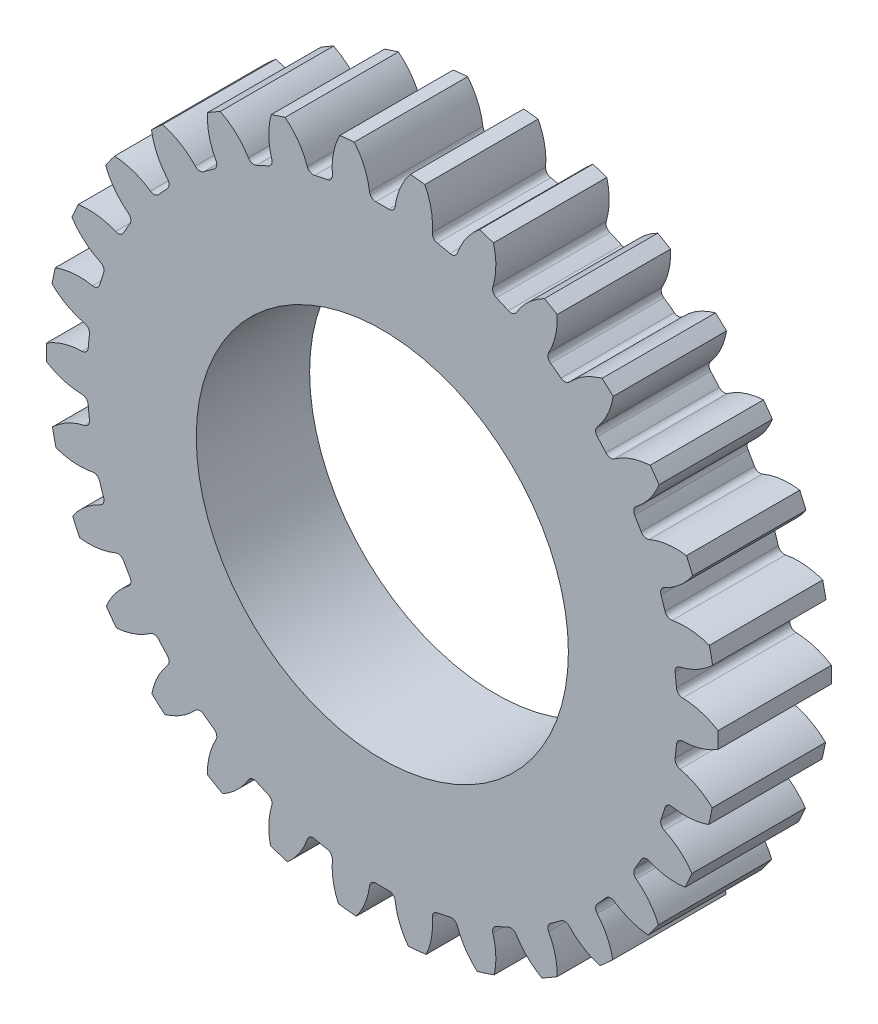
from build123d import *

# Parameters (mm, degrees)
SKETCH1_R                = 26.665
BOSS_EXTRUDE1_DEPTH      = 4.5
CUT_EXTRUDE1_DEPTH       = 8.335
FILLET1_R                = 0.5
CIRPATTERN1_COUNT        = 30
FILLET1_OF_CIRPATTERN1_R = 0.5
SKETCH3_R                = 13
CUT_EXTRUDE2_DEPTH       = 39.713938954
SCALE1_SCALE             = 0.88
SKETCH4_R                = 13
CUT_EXTRUDE3_DEPTH       = 10


with BuildPart() as part:
    # Sketch1 → Boss-Extrude1 (new, symmetric)
    with BuildSketch(Plane.XY):
        Circle(SKETCH1_R)
    extrude(amount=BOSS_EXTRUDE1_DEPTH, both=True)

    # Sketch2 → Cut-Extrude1 (cut, symmetric)
    with BuildSketch(Plane.XY):
        with BuildLine():
            ThreePointArc((0.980310331, 23.309394923), (0, 23.33), (-0.980310331, 23.309394923))
            ThreePointArc((-0.980310331, 23.309394923), (-1.606891498, 25.641377876), (-3.168766736, 27.48292456))
            ThreePointArc((-3.168766736, 27.48292456), (0, 27.665), (3.168766736, 27.48292456))
            ThreePointArc((3.168766736, 27.48292456), (1.606891498, 25.641377876), (0.980310331, 23.309394923))
        make_face()
    cut_extrude1 = extrude(amount=CUT_EXTRUDE1_DEPTH, both=True, mode=Mode.SUBTRACT)

    # Fillet1
    fillet1_edges = [part.edges().sort_by_distance(p)[0] for p in [
        (0.980310331, 23.309394923, 0),
        (-0.980310331, 23.309394923, 0),
    ]]
    fillet(fillet1_edges, radius=FILLET1_R)

    # CirPattern1: Cut-Extrude1 ×30 about axis
    cirpattern1_axis = Axis((0, -0.105317808, 0), (0, 0, 1))
    for i in range(1, CIRPATTERN1_COUNT):
        add(cut_extrude1.rotate(cirpattern1_axis, i * 360 / CIRPATTERN1_COUNT), mode=Mode.SUBTRACT)

    # Fillet1 of CirPattern1
    fillet1_of_cirpattern1_edges = [part.edges().sort_by_distance(p)[0] for p in [
        (-3.909304315, 23.00154525, 0),
        (-5.827080712, 22.593909293, 0),
        (-8.628063605, 21.683814782, 0),
        (-10.419179705, 20.886358516, 0),
        (-12.969735112, 19.413794665, 0),
        (-14.555910547, 18.261370754, 0),
        (-16.74456696, 16.290695669, 0),
        (-18.056478252, 14.833670569, 0),
        (-19.787580882, 12.451012208, 0),
        (-20.767891213, 10.753064907, 0),
        (-21.965782568, 8.062556872, 0),
        (-22.571647672, 6.197895816, 0),
        (-23.183974152, 3.31712622, 0),
        (-23.388914817, 1.367246043, 0),
        (-23.388914817, -1.577881659, 0),
        (-23.183974152, -3.527761836, 0),
        (-22.571647672, -6.408531432, 0),
        (-21.965782568, -8.273192489, 0),
        (-20.767891213, -10.963700523, 0),
        (-19.787580882, -12.661647824, 0),
        (-18.056478252, -15.044306185, 0),
        (-16.74456696, -16.501331285, 0),
        (-14.555910547, -18.47200637, 0),
        (-12.969735112, -19.624430281, 0),
        (-10.419179705, -21.096994132, 0),
        (-8.628063605, -21.894450399, 0),
        (-5.827080712, -22.804544909, 0),
        (-3.909304315, -23.212180866, 0),
        (-0.980310331, -23.520030539, 0),
        (0.980310331, -23.520030539, 0),
        (3.909304315, -23.212180866, 0),
        (5.827080712, -22.804544909, 0),
        (8.628063605, -21.894450399, 0),
        (10.419179705, -21.096994132, 0),
        (12.969735112, -19.624430281, 0),
        (14.555910547, -18.47200637, 0),
        (16.74456696, -16.501331285, 0),
        (18.056478252, -15.044306185, 0),
        (19.787580882, -12.661647824, 0),
        (20.767891213, -10.963700523, 0),
        (21.965782568, -8.273192489, 0),
        (22.571647672, -6.408531432, 0),
        (23.183974152, -3.527761836, 0),
        (23.388914817, -1.577881659, 0),
        (23.388914817, 1.367246043, 0),
        (23.183974152, 3.31712622, 0),
        (22.571647672, 6.197895816, 0),
        (21.965782568, 8.062556872, 0),
        (20.767891213, 10.753064907, 0),
        (19.787580882, 12.451012208, 0),
        (18.056478252, 14.833670569, 0),
        (16.74456696, 16.290695669, 0),
        (14.555910547, 18.261370754, 0),
        (12.969735112, 19.413794665, 0),
        (10.419179705, 20.886358516, 0),
        (8.628063605, 21.683814782, 0),
        (5.827080712, 22.593909293, 0),
        (3.909304315, 23.00154525, 0),
    ]]
    fillet(fillet1_of_cirpattern1_edges, radius=FILLET1_OF_CIRPATTERN1_R)

    # Sketch3 → Cut-Extrude2 (cut, through all)
    with BuildSketch(Plane.XY.offset(4.5)):
        Circle(SKETCH3_R)
    extrude(amount=-CUT_EXTRUDE2_DEPTH, mode=Mode.SUBTRACT)


with BuildPart() as part_1:
    # Scale1: scaled about (0, -0.10634366, 0)
    add(part.part.scale(SCALE1_SCALE).moved(Location((0, -0.012761239, 0))))

    # Sketch4 → Cut-Extrude3 (cut)
    with BuildSketch(Plane.XY.offset(3.96)):
        with Locations((0, -0.012761239)):
            Circle(SKETCH4_R)
    extrude(amount=-CUT_EXTRUDE3_DEPTH, mode=Mode.SUBTRACT)


solid = part_1.part
